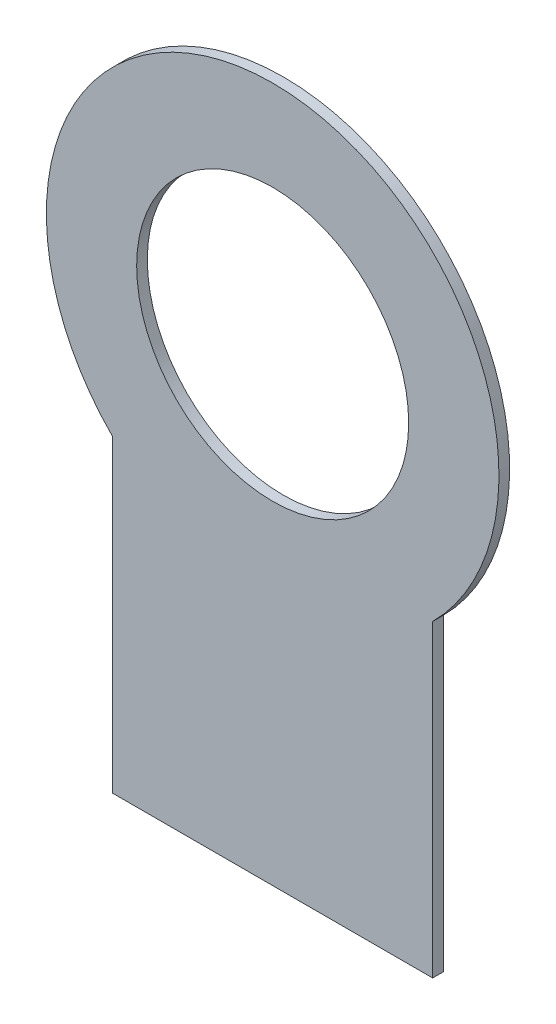
from build123d import *

# Parameters (mm, degrees)
SKETCH_1_R      = 25.5
EXTRUDE_1_DEPTH = 2


with BuildPart() as part:
    # 草图1 → 凸台-拉伸1 (new body)
    # profile 1 of 5: a face of its own
    with BuildSketch(Plane.XY):
        with BuildLine():
            Line((-30, -30), (-30, -87.891535797))
            Line((-30, -87.891535797), (30, -87.891535797))
            Line((30, -87.891535797), (30, -30))
            ThreePointArc((30, -30), (0, -42.426406871), (-30, -30))
        make_face()
    # profile 2 of 5: a face of its own
    with BuildSketch(Plane.XY):
        with BuildLine():
            Line((-30, 30), (-30, -30))
            ThreePointArc((-30, -30), (0, -42.426406871), (30, -30))
            Line((30, -30), (30, 30))
            Line((30, 30), (-30, 30))
        make_face()
        Circle(SKETCH_1_R, mode=Mode.SUBTRACT)
    # profile 3 of 5: a face of its own
    with BuildSketch(Plane.XY):
        with BuildLine():
            ThreePointArc((-30, 30), (-42.426406871, 0), (-30, -30))
            Line((-30, -30), (-30, 30))
        make_face()
    # profile 4 of 5: a face of its own
    with BuildSketch(Plane.XY):
        with BuildLine():
            Line((30, 30), (30, -30))
            ThreePointArc((30, -30), (39.196888946, -16.235883004), (42.426406871, 0))
            ThreePointArc((42.426406871, 0), (39.196888946, 16.235883004), (30, 30))
        make_face()
    # profile 5 of 5: a face of its own
    with BuildSketch(Plane.XY):
        with BuildLine():
            ThreePointArc((30, 30), (0, 42.426406871), (-30, 30))
            Line((-30, 30), (30, 30))
        make_face()
    extrude(amount=EXTRUDE_1_DEPTH)


solid = part.part
